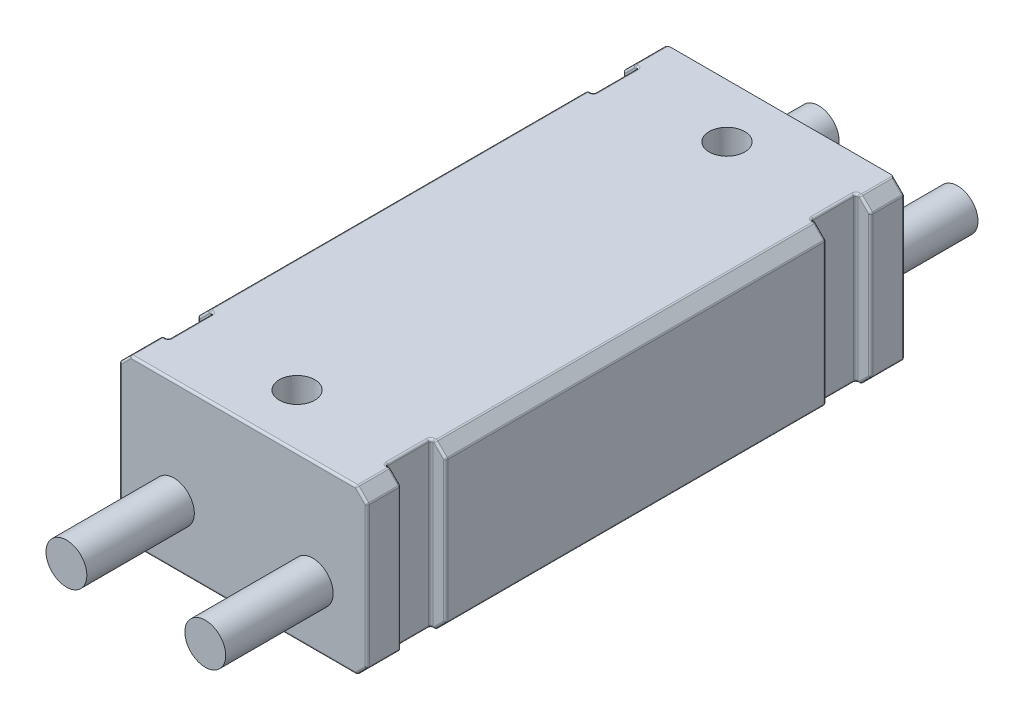
from build123d import *

# Parameters (mm, degrees)
SKETCH1_W           = 29.2862
SKETCH1_H           = 63.5
BOSS_EXTRUDE1_DEPTH = 19.304
SKETCH2_R           = 2.10058
CUT_EXTRUDE1_DEPTH  = 40.939044726
SKETCH3_R           = 2.413
BOSS_EXTRUDE2_DEPTH = 12.7
SKETCH4_W           = 1.778
SKETCH4_H           = 5.2832
CUT_EXTRUDE4_DEPTH  = 51.624769566
CHAMFER1_SIZE       = 1.27
FILLET1_R           = 0.254


with BuildPart() as part:
    # Sketch1 → Boss-Extrude1 (new body)
    with BuildSketch(Plane(origin=(0, 0, 0), x_dir=(1, 0, 0), z_dir=(0, 1, 0))):
        Rectangle(SKETCH1_W, SKETCH1_H)
    extrude(amount=BOSS_EXTRUDE1_DEPTH)

    # Sketch2 → Cut-Extrude1 (cut, through all)
    with BuildSketch(Plane(origin=(0, 19.304, 0), x_dir=(1, 0, 0), z_dir=(0, 1, 0))):
        with Locations(Location((0, 25.4, 0), (0, 0, 270))):
            Circle(SKETCH2_R)
        with Locations(Location((0, -25.4, 0), (0, 0, 270))):
            Circle(SKETCH2_R)
    extrude(amount=-CUT_EXTRUDE1_DEPTH, mode=Mode.SUBTRACT)

    # Sketch3 → Boss-Extrude2 (add)
    with BuildSketch(Plane.XY.offset(31.75)):
        with Locations(Location((-8.2042, 6.9596, 0), (0, 0, 180))):
            Circle(SKETCH3_R)
        with Locations(Location((8.2042, 6.9596, 0), (0, 0, 180))):
            Circle(SKETCH3_R)
    boss_extrude2 = extrude(amount=BOSS_EXTRUDE2_DEPTH)

    # Sketch4 → Cut-Extrude4 (cut, through all)
    with BuildSketch(Plane(origin=(0, 0, 0), x_dir=(1, 0, 0), z_dir=(0, 1, 0))):
        with Locations((13.7541, -25.1206)):
            Rectangle(SKETCH4_W, SKETCH4_H)
        with Locations((-13.7541, -25.1206)):
            Rectangle(SKETCH4_W, SKETCH4_H)
        with Locations((-13.7541, 25.1206)):
            Rectangle(SKETCH4_W, SKETCH4_H)
        with Locations((13.7541, 25.1206)):
            Rectangle(SKETCH4_W, SKETCH4_H)
    extrude(amount=CUT_EXTRUDE4_DEPTH, mode=Mode.SUBTRACT)

    # Chamfer1
    chamfer1_edges = [part.edges().sort_by_distance(p)[0] for p in [
        (14.6431, 19.304, 29.7561),
        (14.6431, 0, 0),
        (14.6431, 19.304, 0),
        (-14.6431, 19.304, -29.7561),
        (-14.6431, 0, 0),
        (-14.6431, 0, 29.7561),
        (-14.6431, 19.304, 0),
        (-14.6431, 19.304, 29.7561),
        (14.6431, 0, -29.7561),
        (14.6431, 0, 29.7561),
        (14.6431, 19.304, -29.7561),
        (-14.6431, 0, -29.7561),
    ]]
    chamfer(chamfer1_edges, length=CHAMFER1_SIZE)

    # Mirror1: Boss-Extrude2 across plane
    add(boss_extrude2.mirror(Plane.XY))

    # Fillet1
    fillet1_edges = [part.edges().sort_by_distance(p)[0] for p in [
        (-13.3731, 0, 0),
        (13.3731, 0, 29.7561),
        (-13.3731, 0, 29.7561),
        (-13.3731, 0, -29.7561),
        (13.3731, 0, -29.7561),
        (13.1191, 19.304, -27.7622),
        (14.0081, 18.669, -27.7622),
        (14.0081, 0.635, -27.7622),
        (-14.6431, 9.652, -27.7622),
        (-14.6431, 18.034, -29.7561),
        (-14.6431, 1.27, -29.7561),
        (-14.0081, 18.669, -27.7622),
        (-14.0081, 0.635, -27.7622),
        (-14.6431, 9.652, 27.7622),
        (-14.6431, 9.652, 31.75),
        (-14.6431, 18.034, 29.7561),
        (-14.6431, 1.27, 29.7561),
        (14.6431, 9.652, 31.75),
        (0, 19.304, 31.75),
        (14.0081, 18.669, 31.75),
        (-14.0081, 18.669, 31.75),
        (14.0081, 0.635, 31.75),
        (-14.0081, 0.635, 31.75),
        (-13.1191, 19.304, 27.7622),
        (-14.0081, 18.669, 27.7622),
        (-14.0081, 0.635, 27.7622),
        (14.6431, 9.652, 27.7622),
        (14.6431, 18.034, 29.7561),
        (14.6431, 1.27, 29.7561),
        (14.0081, 18.669, 27.7622),
        (14.0081, 0.635, 27.7622),
        (13.1191, 19.304, 22.479),
        (-13.1191, 19.304, -22.479),
        (13.3731, 19.304, 29.7561),
        (-13.3731, 19.304, 0),
        (13.3731, 19.304, 0),
        (13.3731, 19.304, -29.7561),
        (-13.3731, 19.304, -29.7561),
        (-13.3731, 19.304, 29.7561),
        (14.6431, 9.652, -22.479),
        (14.0081, 0.635, -22.479),
        (14.0081, 18.669, -22.479),
        (14.6431, 9.652, 22.479),
        (14.6431, 1.27, 0),
        (14.6431, 18.034, 0),
        (14.0081, 0.635, 22.479),
        (14.0081, 18.669, 22.479),
        (-14.6431, 9.652, 22.479),
        (-14.6431, 9.652, -22.479),
        (-14.6431, 18.034, 0),
        (-14.6431, 1.27, 0),
        (-14.0081, 18.669, 22.479),
        (-14.0081, 0.635, 22.479),
        (-14.0081, 18.669, -22.479),
        (-14.0081, 0.635, -22.479),
        (12.8651, 0, 25.1206),
        (12.8651, 9.652, 22.479),
        (13.1191, 0, 27.7622),
        (12.8651, 9.652, 27.7622),
        (12.8651, 19.304, 25.1206),
        (13.1191, 19.304, 27.7622),
        (-12.8651, 0, 25.1206),
        (-12.8651, 9.652, 27.7622),
        (-13.1191, 0, 22.479),
        (-12.8651, 9.652, 22.479),
        (-12.8651, 19.304, 25.1206),
        (-13.1191, 19.304, 22.479),
        (-12.8651, 0, -25.1206),
        (-12.8651, 9.652, -22.479),
        (-13.1191, 0, -27.7622),
        (-12.8651, 9.652, -27.7622),
        (-12.8651, 19.304, -25.1206),
        (-13.1191, 19.304, -27.7622),
        (12.8651, 0, -25.1206),
        (12.8651, 9.652, -27.7622),
        (13.1191, 0, -22.479),
        (12.8651, 9.652, -22.479),
        (12.8651, 19.304, -25.1206),
        (13.1191, 19.304, -22.479),
        (14.6431, 9.652, -27.7622),
        (14.6431, 9.652, -31.75),
        (14.6431, 18.034, -29.7561),
        (14.6431, 1.27, -29.7561),
        (-14.6431, 9.652, -31.75),
        (14.0081, 18.669, -31.75),
        (-14.0081, 18.669, -31.75),
        (-14.0081, 0.635, -31.75),
        (14.0081, 0.635, -31.75),
        (-13.1191, 0, 27.7622),
        (-13.1191, 0, -22.479),
        (13.1191, 0, -27.7622),
        (13.1191, 0, 22.479),
        (0, 0, 31.75),
        (13.3731, 0, 0),
    ]]
    fillet(fillet1_edges, radius=FILLET1_R)


solid = part.part
